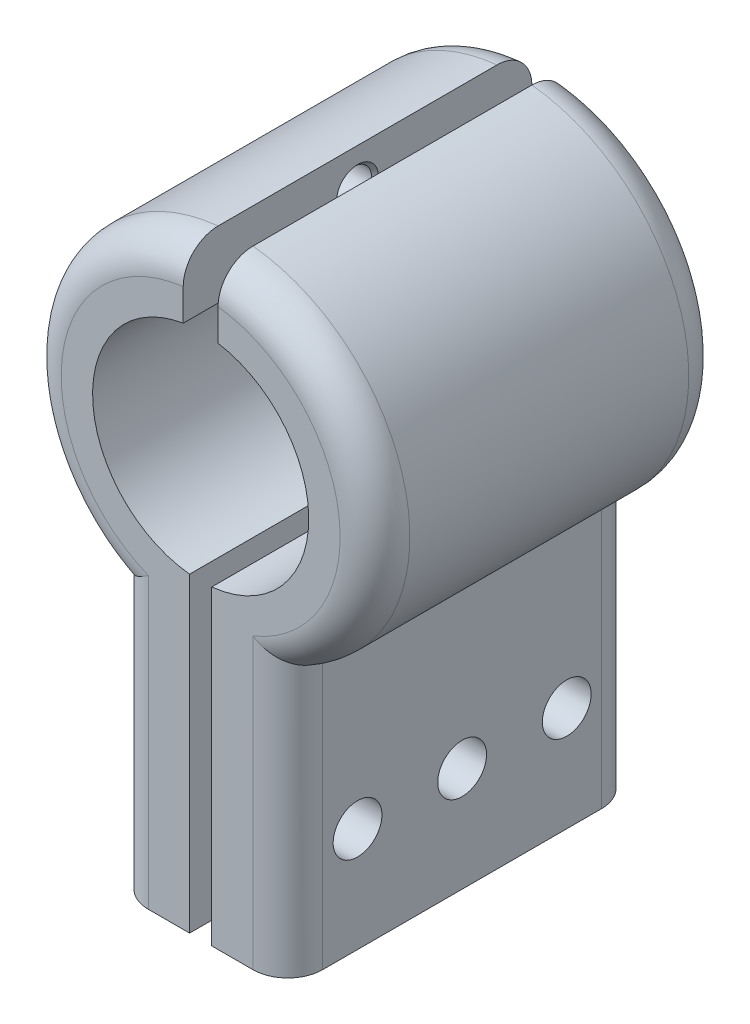
from build123d import *

# Parameters (mm, degrees)
BOSS_EXTRUDE1_DEPTH     = 25
BOSS_EXTRUDE1_2_DEPTH   = 25
FILLET1_R               = 5
FILLET2_R               = 5
CUT_EXTRUDE1_DEPTH      = 76.041655262
CUT_EXTRUDE1_DEPTH_BACK = 76.041655262
SKETCH3_R               = 3.5
SKETCH4_R               = 2.5
CUT_EXTRUDE2_DEPTH      = 8
CHAMFER1_SIZE           = 0.5
CHAMFER2_SIZE           = 0.5


with BuildPart() as part:
    # Sketch1 → Boss-Extrude1 (new, symmetric)
    with BuildSketch(Plane.XY):
        with BuildLine():
            Line((-12.5, -21.650635095), (-12.5, -60))
            Line((-12.5, -60), (-1.59, -60))
            Line((-1.59, -60), (-1.59, -15.418232713))
            ThreePointArc((-1.59, -15.418232713), (-15.493201871, -0.459016116), (-2.5, 15.297058541))
            Line((-2.5, 15.297058541), (-2.5, 24.874685928))
            ThreePointArc((-2.5, 24.874685928), (-24.441795639, 5.253439439), (-12.5, -21.650635095))
        make_face()
    extrude(amount=BOSS_EXTRUDE1_DEPTH, both=True)

    # Fillet1
    fillet1_edges = [part.edges().sort_by_distance(p)[0] for p in [
        (-24.441795639, 5.253439439, 25),
        (-12.5, -40.825317547, -25),
        (-24.441795639, 5.253439439, -25),
        (-12.5, -40.825317547, 25),
    ]]
    fillet(fillet1_edges, radius=FILLET1_R)


with BuildPart() as body_2:
    # Sketch1 → Boss-Extrude1 2 (new, symmetric)
    with BuildSketch(Plane.XY):
        with BuildLine():
            Line((12.5, -21.650635095), (12.5, -60))
            Line((12.5, -60), (1.59, -60))
            Line((1.59, -60), (1.59, -15.418232713))
            ThreePointArc((1.59, -15.418232713), (15.493201871, -0.459016116), (2.5, 15.297058541))
            Line((2.5, 15.297058541), (2.5, 24.874685928))
            ThreePointArc((2.5, 24.874685928), (24.441795639, 5.253439439), (12.5, -21.650635095))
        make_face()
    extrude(amount=BOSS_EXTRUDE1_2_DEPTH, both=True)

    # Fillet2
    fillet2_edges = [body_2.edges().sort_by_distance(p)[0] for p in [
        (12.5, -40.825317547, -25),
        (24.441795639, 5.253439439, -25),
        (12.5, -40.825317547, 25),
        (24.441795639, 5.253439439, 25),
    ]]
    fillet(fillet2_edges, radius=FILLET2_R)


with BuildPart() as cut_extrude1_tool:
    # Sketch3 → Cut-Extrude1 (new, two sides: drawn at the far end of the back side and taken through both)
    with BuildSketch(Plane.ZY.offset(12.5).offset(-CUT_EXTRUDE1_DEPTH_BACK)):
        with Locations(Location((0, -45, 0), (0, 0, 270))):
            Circle(SKETCH3_R)
        with Locations(Location((-15, -45, 0), (0, 0, 270))):
            Circle(SKETCH3_R)
        with Locations(Location((15, -45, 0), (0, 0, 270))):
            Circle(SKETCH3_R)
    extrude(amount=CUT_EXTRUDE1_DEPTH + CUT_EXTRUDE1_DEPTH_BACK)


with BuildPart() as part_1:
    add(part.part)

    # Cut-Extrude1: cut by cut_extrude1_tool
    add(cut_extrude1_tool.part, mode=Mode.SUBTRACT)


with BuildPart() as body_2_1:
    add(body_2.part)

    # Cut-Extrude1: cut by cut_extrude1_tool
    add(cut_extrude1_tool.part, mode=Mode.SUBTRACT)


with BuildPart() as cut_extrude2_tool:
    # Sketch4 → Cut-Extrude2 (new, symmetric)
    with BuildSketch(Plane(origin=(0, 0, 0), x_dir=(0, 0, -1), z_dir=(1, 0, 0))):
        with Locations((0, 19.5)):
            Circle(SKETCH4_R)
    extrude(amount=CUT_EXTRUDE2_DEPTH, both=True)


with BuildPart() as part_2:
    add(part_1.part)

    # Cut-Extrude2: cut by cut_extrude2_tool
    add(cut_extrude2_tool.part, mode=Mode.SUBTRACT)

    # Chamfer1
    chamfer1_edges = [part_2.edges().sort_by_distance(p)[0] for p in [
        (-8, 19.5, 2.5),
        (-2.5, 19.5, 2.5),
    ]]
    chamfer(chamfer1_edges, length=CHAMFER1_SIZE)


with BuildPart() as body_2_2:
    add(body_2_1.part)

    # Cut-Extrude2: cut by cut_extrude2_tool
    add(cut_extrude2_tool.part, mode=Mode.SUBTRACT)

    # Chamfer2
    chamfer2_edges = [body_2_2.edges().sort_by_distance(p)[0] for p in [
        (2.5, 19.5, 2.5),
        (8, 19.5, 2.5),
    ]]
    chamfer(chamfer2_edges, length=CHAMFER2_SIZE)


solid = Compound([part_2.part, body_2_2.part])
